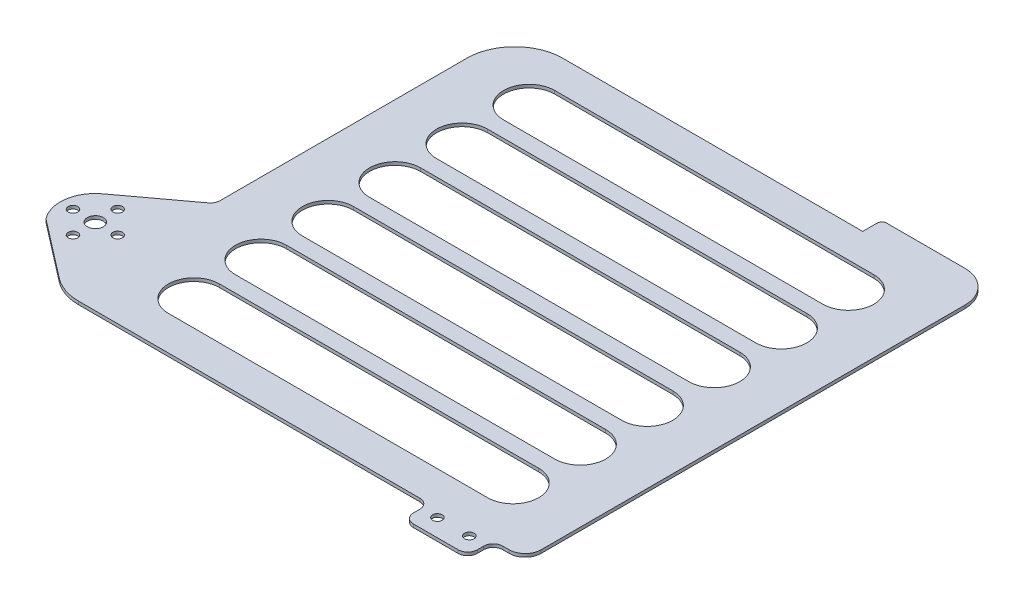
from build123d import *

# Parameters (mm, degrees)
SKETCH_1_W               = 145
SKETCH_1_H               = 141.74
EXTRUDE_1_DEPTH          = 1
FILLET_1_R               = 15
EXTRUDE_2_DEPTH          = 1
SKETCH_3_R               = 2.5
SKETCH_3_R_2             = 1.5
CUT_EXTRUDE_1_DEPTH      = 127.962285976
PATTERN_CIRCULAR_1_COUNT = 4
CUT_EXTRUDE_2_DEPTH      = 127.962285976
FILLET_2_R               = 15
FILLET_3_R               = 3
CUT_EXTRUDE_3_DEPTH      = 121.297119251
SKETCH_6_W               = 36
SKETCH_6_H               = 1
EXTRUDE_3_DEPTH          = 6
FILLET_4_R               = 10
FILLET_5_R               = 1.5
SKETCH_8_W               = 20
SKETCH_8_H               = 8
SKETCH_8_R               = 1.5
EXTRUDE_5_DEPTH          = 1
FILLET_8_R               = 3
FILLET_9_R               = 5


with BuildPart() as part:
    # 草图1 → 凸台-拉伸1 (new body)
    with BuildSketch(Plane(origin=(0, 0, 0), x_dir=(1, 0, 0), z_dir=(0, 1, 0))):
        Rectangle(SKETCH_1_W, SKETCH_1_H)
    extrude(amount=EXTRUDE_1_DEPTH)

    # 圆角1
    fillet_1_edges = [part.edges().sort_by_distance(p)[0] for p in [
        (-72.5, 0.5, -70.87),
    ]]
    fillet(fillet_1_edges, radius=FILLET_1_R)

    # 草图2 → 凸台-拉伸2 (add)
    with BuildSketch(Plane(origin=(0, 1, 0), x_dir=(1, 0, 0), z_dir=(0, 1, 0))):
        with BuildLine():
            Line((-92.747934341, -37.981190359), (-72.5, -22.981190359))
            Line((-72.5, -22.981190359), (-72.5, -81.673631364))
            Line((-72.5, -81.673631364), (-94.803937304, -53.673631364))
            ThreePointArc((-94.803937304, -53.673631364), (-97.10678595, -45.391007263), (-92.747934341, -37.981190359))
        make_face()
    extrude(amount=-EXTRUDE_2_DEPTH)

    # 草图3 → 切除-拉伸1 (cut, through all)
    with BuildSketch(Plane(origin=(0, 1, 0), x_dir=(1, 0, 0), z_dir=(0, 1, 0))):
        with Locations(Location((-86.2, -46.82, 0), (0, 0, 270))):
            Circle(SKETCH_3_R)
        with Locations(Location((-93.2, -46.82, 0), (0, 0, 270))):
            Circle(SKETCH_3_R_2)
    cut_extrude_1 = extrude(amount=-CUT_EXTRUDE_1_DEPTH, mode=Mode.SUBTRACT)

    # 阵列(圆周)1: 切除-拉伸1 ×4 about axis
    pattern_circular_1_axis = Axis((-86.2, 0, 46.82), (0, 1, 0))
    for i in range(1, PATTERN_CIRCULAR_1_COUNT):
        add(cut_extrude_1.rotate(pattern_circular_1_axis, i * 360 / PATTERN_CIRCULAR_1_COUNT), mode=Mode.SUBTRACT)

    # 草图4 → 切除-拉伸2 (cut, through all)
    with BuildSketch(Plane(origin=(0, 1, 0), x_dir=(1, 0, 0), z_dir=(0, 1, 0))):
        Polygon((-72.5, -70.87), (-94.803937304, -53.673631364), (-72.5, -88.862813476), align=None)
    extrude(amount=-CUT_EXTRUDE_2_DEPTH, mode=Mode.SUBTRACT)

    # 圆角2
    fillet_2_edges = [part.edges().sort_by_distance(p)[0] for p in [
        (-72.5, 0.5, 70.87),
    ]]
    fillet(fillet_2_edges, radius=FILLET_2_R)

    # 圆角3
    fillet_3_edges = [part.edges().sort_by_distance(p)[0] for p in [
        (-72.5, 0.5, 22.981190359),
    ]]
    fillet(fillet_3_edges, radius=FILLET_3_R)

    # 草图5 → 切除-拉伸3 (cut, through all)
    with BuildSketch(Plane(origin=(0, 1, 0), x_dir=(1, 0, 0), z_dir=(0, 1, 0))):
        with BuildLine():
            Line((-50, 60.87), (50, 60.87))
            ThreePointArc((50, 60.87), (58, 52.87), (50, 44.87))
            Line((50, 44.87), (-50, 44.87))
            ThreePointArc((-50, 44.87), (-58, 52.87), (-50, 60.87))
        make_face()
        with BuildLine():
            Line((-50, 39.87), (50, 39.87))
            ThreePointArc((50, 39.87), (58, 31.87), (50, 23.87))
            Line((50, 23.87), (-50, 23.87))
            ThreePointArc((-50, 23.87), (-58, 31.87), (-50, 39.87))
        make_face()
        with BuildLine():
            Line((-50, 18.87), (50, 18.87))
            ThreePointArc((50, 18.87), (58, 10.87), (50, 2.87))
            Line((50, 2.87), (-50, 2.87))
            ThreePointArc((-50, 2.87), (-58, 10.87), (-50, 18.87))
        make_face()
        with BuildLine():
            Line((-50, -2.13), (50, -2.13))
            ThreePointArc((50, -2.13), (58, -10.13), (50, -18.13))
            Line((50, -18.13), (-50, -18.13))
            ThreePointArc((-50, -18.13), (-58, -10.13), (-50, -2.13))
        make_face()
        with BuildLine():
            Line((-50, -23.13), (50, -23.13))
            ThreePointArc((50, -23.13), (58, -31.13), (50, -39.13))
            Line((50, -39.13), (-50, -39.13))
            ThreePointArc((-50, -39.13), (-58, -31.13), (-50, -23.13))
        make_face()
        with BuildLine():
            Line((-50, -44.13), (50, -44.13))
            ThreePointArc((50, -44.13), (58, -52.13), (50, -60.13))
            Line((50, -60.13), (-50, -60.13))
            ThreePointArc((-50, -60.13), (-58, -52.13), (-50, -44.13))
        make_face()
    extrude(amount=-CUT_EXTRUDE_3_DEPTH, mode=Mode.SUBTRACT)

    # 草图6 → 凸台-拉伸3 (add)
    with BuildSketch(Plane(origin=(0, 0, -70.87), x_dir=(-1, 0, 0), z_dir=(0, 0, -1))):
        with Locations((-54.5, 0.5)):
            Rectangle(SKETCH_6_W, SKETCH_6_H)
    extrude(amount=EXTRUDE_3_DEPTH)

    # 圆角4
    fillet_4_edges = [part.edges().sort_by_distance(p)[0] for p in [
        (72.5, 0.5, -76.87),
    ]]
    fillet(fillet_4_edges, radius=FILLET_4_R)

    # 圆角5
    fillet_5_edges = [part.edges().sort_by_distance(p)[0] for p in [
        (36.5, 0.5, -76.87),
    ]]
    fillet(fillet_5_edges, radius=FILLET_5_R)

    # 草图8 → 凸台-拉伸5 (add)
    with BuildSketch(Plane(origin=(0, 1, 0), x_dir=(1, 0, 0), z_dir=(0, 1, 0))):
        with Locations((52.5, -74.87)):
            Rectangle(SKETCH_8_W, SKETCH_8_H)
        with Locations(Location((47.504832843, -73.37, 0), (0, 0, 270))):
            Circle(SKETCH_8_R, mode=Mode.SUBTRACT)
        with Locations(Location((57.504832843, -73.37, 0), (0, 0, 270))):
            Circle(SKETCH_8_R, mode=Mode.SUBTRACT)
    extrude(amount=-EXTRUDE_5_DEPTH)

    # 圆角8
    fillet_8_edges = [part.edges().sort_by_distance(p)[0] for p in [
        (62.5, 0.5, 70.87),
        (62.5, 0.5, 78.87),
        (42.5, 0.5, 78.87),
        (42.5, 0.5, 70.87),
    ]]
    fillet(fillet_8_edges, radius=FILLET_8_R)

    # 圆角9
    fillet_9_edges = [part.edges().sort_by_distance(p)[0] for p in [
        (72.5, 0.5, 70.87),
    ]]
    fillet(fillet_9_edges, radius=FILLET_9_R)


solid = part.part
